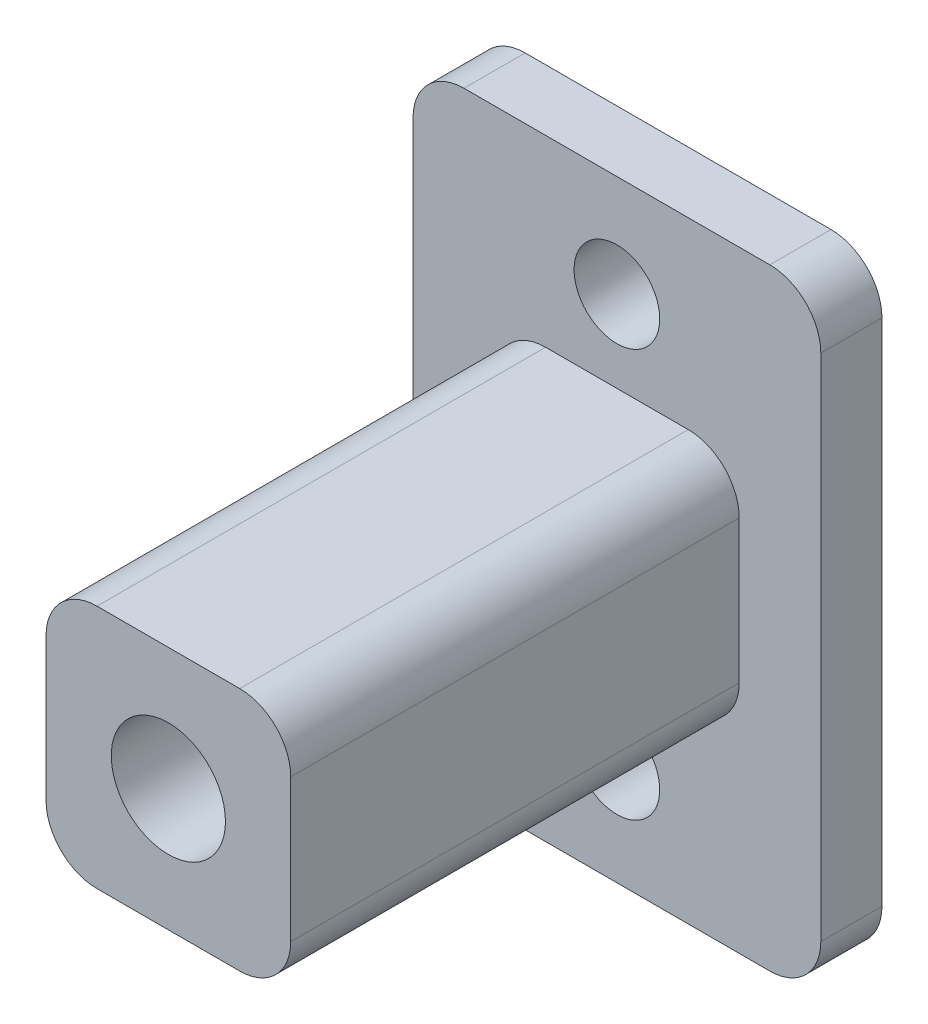
from build123d import *

# Parameters (mm, degrees)
ESQUISSE1_W             = 20
ESQUISSE1_H             = 30
ESQUISSE1_R             = 2.1
BOSS_EXTRU_1_DEPTH      = 3
ESQUISSE2_W             = 12
ESQUISSE2_H             = 12
BOSS_EXTRU_2_DEPTH      = 22
ESQUISSE3_OUTSIDE_W     = 30.774
ESQUISSE3_OUTSIDE_H     = 40.774
ESQUISSE3_OUTSIDE_W_2   = 12
ESQUISSE3_OUTSIDE_H_2   = 12
ESQUISSE3_OUTSIDE_R     = 2.8
ENL_V_MAT_EXTRU_1_DEPTH = 9.1
CONG_1_R                = 2.5


with BuildPart() as part:
    # Esquisse1 → Boss.-Extru.1 (new body)
    with BuildSketch(Plane.XY):
        Rectangle(ESQUISSE1_W, ESQUISSE1_H)
        with Locations((0, 10)):
            Circle(ESQUISSE1_R, mode=Mode.SUBTRACT)
        with Locations(Location((0, -10, 0), (0, 0, 180))):
            Circle(ESQUISSE1_R, mode=Mode.SUBTRACT)
    extrude(amount=BOSS_EXTRU_1_DEPTH)

    # Esquisse2 → Boss.-Extru.2 (add)
    with BuildSketch(Plane.XY.offset(3)):
        Rectangle(ESQUISSE2_W, ESQUISSE2_H)
    extrude(amount=BOSS_EXTRU_2_DEPTH)

    # Esquisse3 outside → Enlèv. mat.-Extru.1 (cut)
    # profile 1 of 2: a face of its own
    with BuildSketch(Plane.XY.offset(25)):
        Rectangle(ESQUISSE3_OUTSIDE_W, ESQUISSE3_OUTSIDE_H)
        Rectangle(ESQUISSE3_OUTSIDE_W_2, ESQUISSE3_OUTSIDE_H_2, mode=Mode.SUBTRACT)
    # profile 2 of 2: a face of its own
    with BuildSketch(Plane.XY.offset(25)):
        Circle(ESQUISSE3_OUTSIDE_R)
    extrude(amount=-ENL_V_MAT_EXTRU_1_DEPTH, mode=Mode.SUBTRACT)

    # Congé1
    cong_1_edges = [part.edges().sort_by_distance(p)[0] for p in [
        (-6, 6, 14),
        (-6, -6, 14),
        (6, -6, 14),
        (6, 6, 14),
        (-10, 15, 1.5),
        (10, 15, 1.5),
        (10, -15, 1.5),
        (-10, -15, 1.5),
    ]]
    fillet(cong_1_edges, radius=CONG_1_R)


solid = part.part
